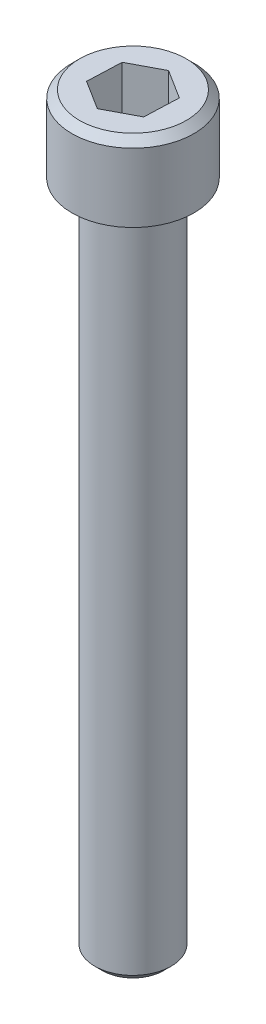
from build123d import *

# Parameters (mm, degrees)
SKETCH1_R           = 5
BOSS_EXTRUDE1_DEPTH = 88
SKETCH2_R           = 8
BOSS_EXTRUDE2_DEPTH = 10
CUT_EXTRUDE1_DEPTH  = 7


with BuildPart() as part:
    # Sketch1 → Boss-Extrude1 (new body)
    with BuildSketch(Plane(origin=(0, 0, 0), x_dir=(1, 0, 0), z_dir=(0, 1, 0))):
        with Locations(Location((0, 0, 0), (0, 0, 270))):
            Circle(SKETCH1_R)
    extrude(amount=BOSS_EXTRUDE1_DEPTH)

    # Sketch2 → Boss-Extrude2 (add)
    with BuildSketch(Plane(origin=(0, 88, 0), x_dir=(1, 0, 0), z_dir=(0, 1, 0))):
        with Locations(Location((0, 0, 0), (0, 0, 270))):
            Circle(SKETCH2_R)
    extrude(amount=BOSS_EXTRUDE2_DEPTH)

    # Sketch3 → Cut-Revolve1 (revolve, cut)
    with BuildSketch(Plane.XY, mode=Mode.PRIVATE) as cut_revolve1_sk:
        Polygon((8, 98), (8, 97), (7, 98), align=None)
    revolve(cut_revolve1_sk.sketch.rotate(Axis((0, 98, 0), (0, -1, 0)), 90), axis=Axis((0, 98, 0), (0, -1, 0)), mode=Mode.SUBTRACT)

    # Sketch4 → Cut-Revolve2 (revolve, cut)
    with BuildSketch(Plane.XY, mode=Mode.PRIVATE) as cut_revolve2_sk:
        Polygon((5, 0), (4, 0), (5, 1), align=None)
    revolve(cut_revolve2_sk.sketch.rotate(Axis((0, 0, 0), (0, 1, 0)), 90), axis=Axis((0, 0, 0), (0, 1, 0)), mode=Mode.SUBTRACT)

    # Sketch5 → Cut-Extrude1 (cut)
    with BuildSketch(Plane(origin=(0, 98, 0), x_dir=(1, 0, 0), z_dir=(0, 1, 0))):
        Polygon((-0.172380767, -4.496697107), (3.808063544, -2.397634677), (3.980444311, 2.09906243), (0.172380767, 4.496697107), (-3.808063544, 2.397634677), (-3.980444311, -2.09906243), align=None)
    extrude(amount=-CUT_EXTRUDE1_DEPTH, mode=Mode.SUBTRACT)


solid = part.part
